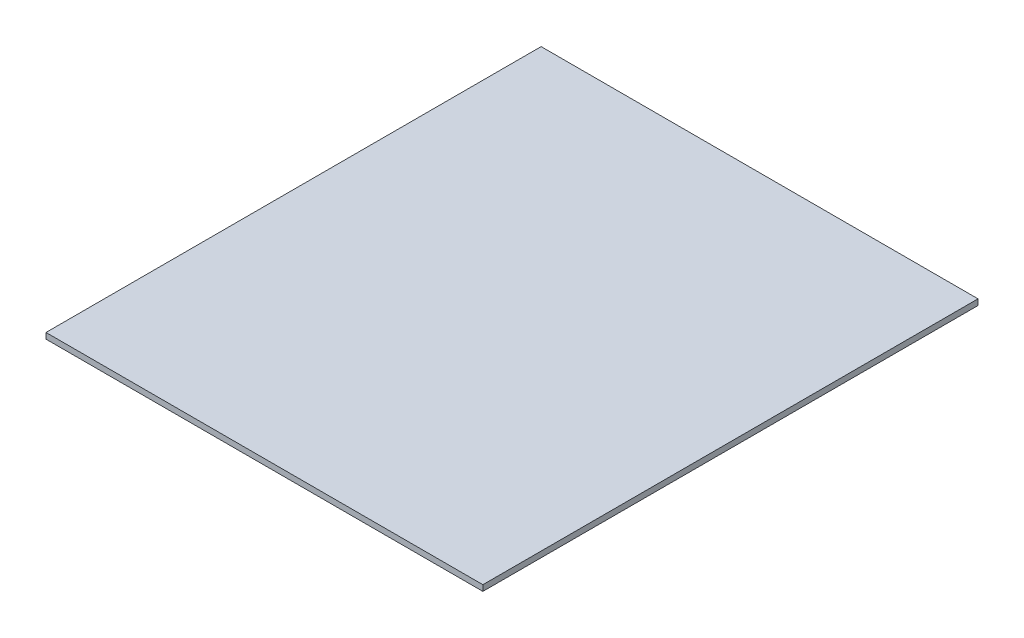
from build123d import *

# Parameters (mm, degrees)
SKETCH1_W           = 150
SKETCH1_H           = 170
BOSS_EXTRUDE1_DEPTH = 2


with BuildPart() as part:
    # Sketch1 → Boss-Extrude1 (new body)
    with BuildSketch(Plane(origin=(0, 0, 0), x_dir=(1, 0, 0), z_dir=(0, 1, 0))):
        with Locations((4.790568177, -20.463013805)):
            Rectangle(SKETCH1_W, SKETCH1_H)
    extrude(amount=BOSS_EXTRUDE1_DEPTH)


solid = part.part
